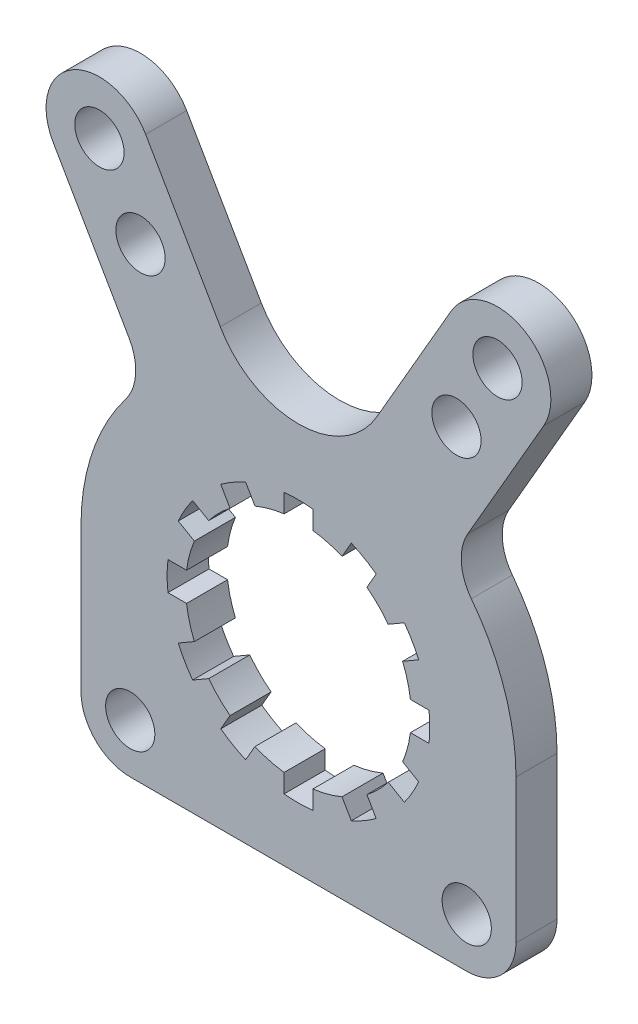
from build123d import *

# Parameters (mm, degrees)
SALIENTE_EXTRUIR1_DEPTH = 10
CROQUIS2_R              = 6
CORTAR_EXTRUIR3_DEPTH   = 116.291439701


with BuildPart() as part:
    # Croquis1 → Saliente-Extruir1 (new body)
    with BuildSketch(Plane.XY):
        with BuildLine():
            Line((-59.758330249, 77.504464167), (-41.258330249, 45.461524227))
            ThreePointArc((-41.258330249, 45.461524227), (-39.675513612, 38.689212456), (-42.115133231, 32.176319754))
            ThreePointArc((-42.115133231, 32.176319754), (-50.205089688, 16.983785484), (-53, 0))
            Line((-53, 0), (-53, -35))
            ThreePointArc((-53, -35), (-49.485281374, -43.485281374), (-41, -47))
            Line((-41, -47), (41, -47))
            ThreePointArc((41, -47), (49.485281374, -43.485281374), (53, -35))
            Line((53, -35), (53, 0))
            ThreePointArc((53, 0), (50.205089688, 16.983785484), (42.115133231, 32.176319754))
            ThreePointArc((42.115133231, 32.176319754), (39.675513612, 38.689212456), (41.258330249, 45.461524227))
            Line((41.258330249, 45.461524227), (59.758330249, 77.504464167))
            ThreePointArc((59.758330249, 77.504464167), (55, 95.262794416), (37.241669751, 90.504464167))
            Line((37.241669751, 90.504464167), (19.052558883, 59))
            ThreePointArc((19.052558883, 59), (0, 48), (-19.052558883, 59))
            Line((-19.052558883, 59), (-37.241669751, 90.504464167))
            ThreePointArc((-37.241669751, 90.504464167), (-55, 95.262794416), (-59.758330249, 77.504464167))
        make_face()
    extrude(amount=SALIENTE_EXTRUIR1_DEPTH)

    # Croquis2 → Cortar-Extruir3 (cut, through all)
    with BuildSketch(Plane.XY.offset(10)):
        with Locations((-41, -35)):
            Circle(CROQUIS2_R)
        with Locations((41, -35)):
            Circle(CROQUIS2_R)
        with Locations((-48.5, 84.004464167)):
            Circle(CROQUIS2_R)
        with Locations((48.5, 84.004464167)):
            Circle(CROQUIS2_R)
        with Locations((-38.5, 66.683956091)):
            Circle(CROQUIS2_R)
        with Locations((38.5, 66.683956091)):
            Circle(CROQUIS2_R)
        with BuildLine():
            Line((-3.5, 31.808017857), (-3.5, 27.276363394))
            ThreePointArc((-3.5, 27.276363394), (-7.11752374, 26.562960223), (-10.607092784, 25.372023622))
            Line((-10.607092784, 25.372023622), (-12.872920015, 29.296551508))
            ThreePointArc((-12.872920015, 29.296551508), (-16, 27.712812921), (-18.935097842, 25.796551508))
            Line((-18.935097842, 25.796551508), (-16.66927061, 21.872023622))
            ThreePointArc((-16.66927061, 21.872023622), (-19.445436483, 19.445436483), (-21.872023622, 16.66927061))
            Line((-21.872023622, 16.66927061), (-25.796551508, 18.935097842))
            ThreePointArc((-25.796551508, 18.935097842), (-27.712812921, 16), (-29.296551508, 12.872920015))
            Line((-29.296551508, 12.872920015), (-25.372023622, 10.607092784))
            ThreePointArc((-25.372023622, 10.607092784), (-26.562960223, 7.11752374), (-27.276363394, 3.5))
            Line((-27.276363394, 3.5), (-31.808017857, 3.5))
            ThreePointArc((-31.808017857, 3.5), (-32, 0), (-31.808017857, -3.5))
            Line((-31.808017857, -3.5), (-27.276363394, -3.5))
            ThreePointArc((-27.276363394, -3.5), (-26.562960223, -7.11752374), (-25.372023622, -10.607092784))
            Line((-25.372023622, -10.607092784), (-29.296551508, -12.872920015))
            ThreePointArc((-29.296551508, -12.872920015), (-27.712812921, -16), (-25.796551508, -18.935097842))
            Line((-25.796551508, -18.935097842), (-21.872023622, -16.66927061))
            ThreePointArc((-21.872023622, -16.66927061), (-19.445436483, -19.445436483), (-16.66927061, -21.872023622))
            Line((-16.66927061, -21.872023622), (-18.935097842, -25.796551508))
            ThreePointArc((-18.935097842, -25.796551508), (-16, -27.712812921), (-12.872920015, -29.296551508))
            Line((-12.872920015, -29.296551508), (-10.607092784, -25.372023622))
            ThreePointArc((-10.607092784, -25.372023622), (-7.11752374, -26.562960223), (-3.5, -27.276363394))
            Line((-3.5, -27.276363394), (-3.5, -31.808017857))
            ThreePointArc((-3.5, -31.808017857), (0, -32), (3.5, -31.808017857))
            Line((3.5, -31.808017857), (3.5, -27.276363394))
            ThreePointArc((3.5, -27.276363394), (7.11752374, -26.562960223), (10.607092784, -25.372023622))
            Line((10.607092784, -25.372023622), (12.872920015, -29.296551508))
            ThreePointArc((12.872920015, -29.296551508), (16, -27.712812921), (18.935097842, -25.796551508))
            Line((18.935097842, -25.796551508), (16.66927061, -21.872023622))
            ThreePointArc((16.66927061, -21.872023622), (19.445436483, -19.445436483), (21.872023622, -16.66927061))
            Line((21.872023622, -16.66927061), (25.796551508, -18.935097842))
            ThreePointArc((25.796551508, -18.935097842), (27.712812921, -16), (29.296551508, -12.872920015))
            Line((29.296551508, -12.872920015), (25.372023622, -10.607092784))
            ThreePointArc((25.372023622, -10.607092784), (26.562960223, -7.11752374), (27.276363394, -3.5))
            Line((27.276363394, -3.5), (31.808017857, -3.5))
            ThreePointArc((31.808017857, -3.5), (32, 0), (31.808017857, 3.5))
            Line((31.808017857, 3.5), (27.276363394, 3.5))
            ThreePointArc((27.276363394, 3.5), (26.562960223, 7.11752374), (25.372023622, 10.607092784))
            Line((25.372023622, 10.607092784), (29.296551508, 12.872920015))
            ThreePointArc((29.296551508, 12.872920015), (27.712812921, 16), (25.796551508, 18.935097842))
            Line((25.796551508, 18.935097842), (21.872023622, 16.66927061))
            ThreePointArc((21.872023622, 16.66927061), (19.445436483, 19.445436483), (16.66927061, 21.872023622))
            Line((16.66927061, 21.872023622), (18.935097842, 25.796551508))
            ThreePointArc((18.935097842, 25.796551508), (16, 27.712812921), (12.872920015, 29.296551508))
            Line((12.872920015, 29.296551508), (10.607092784, 25.372023622))
            ThreePointArc((10.607092784, 25.372023622), (7.11752374, 26.562960223), (3.5, 27.276363394))
            Line((3.5, 27.276363394), (3.5, 31.808017857))
            ThreePointArc((3.5, 31.808017857), (0, 32), (-3.5, 31.808017857))
        make_face()
    extrude(amount=-CORTAR_EXTRUIR3_DEPTH, mode=Mode.SUBTRACT)


solid = part.part
